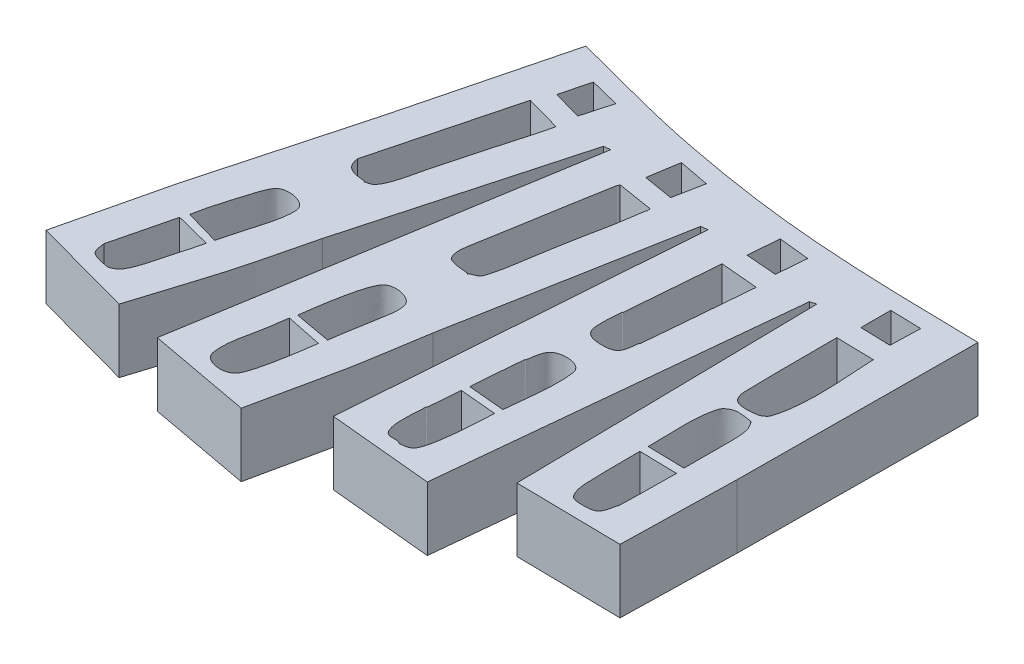
from build123d import *

# Parameters (mm, degrees)
BOSS_EXTRUDE1_DEPTH = 10


with BuildPart() as part:
    # Sketch1 → Boss-Extrude1 (new body)
    with BuildSketch(Plane(origin=(0, 0, 0), x_dir=(1, 0, 0), z_dir=(0, 1, 0))):
        with BuildLine():
            Line((105.416487086, 31.138290659), (105.155761657, -6.406171171))
            Line((105.155761657, -6.406171171), (104.764673512, -24.396225798))
            Line((104.764673512, -24.396225798), (88.338971462, -24.135500369))
            Line((88.338971462, -24.135500369), (87.556795174, 23.707615921))
            Line((87.556795174, 23.707615921), (86.644256171, 23.446890492))
            Line((86.644256171, 23.446890492), (81.169022154, -31.044724247))
            Line((81.169022154, -31.044724247), (64.873682818, -29.480371671))
            Line((64.873682818, -29.480371671), (68.914926973, 25.271968498))
            Line((68.914926973, 25.271968498), (67.872025256, 25.141605783))
            Line((67.872025256, 25.141605783), (61.353889521, -10.317052612))
            add(Edge.make_bspline(
                [(61.353889521, -10.317052612), (60.556431691, -15.101799596), (59.92344026, -19.92042284), (58.876997942, -24.656951228), (58.071680645, -28.302071624), (57.312645366, -31.95726325), (56.530469078, -35.607419262)],
                knots=[0, 0, 0, 0, 1, 1, 1, 2, 2, 2, 2], degree=3))
            Line((56.530469078, -35.607419262), (40.365492457, -32.609076824))
            Line((40.365492457, -32.609076824), (50.403421488, 28.531036365))
            Line((50.403421488, 28.531036365), (49.36051977, 28.40067365))
            Line((49.36051977, 28.40067365), (39.844041598, -6.145445742))
            add(Edge.make_bspline(
                [(39.844041598, -6.145445742), (38.60367941, -10.973998546), (37.570305388, -15.863546829), (36.063522872, -20.615707072), (34.962711789, -24.087495872), (33.890810961, -27.568385189), (32.804455005, -31.044724247)],
                knots=[0, 0, 0, 0, 1, 1, 1, 2, 2, 2, 2], degree=3))
            Line((32.804455005, -31.044724247), (17.030566528, -26.742754663))
            Line((17.030566528, -26.742754663), (21.071810683, -9.795601753))
            Line((21.071810683, -9.795601753), (27.720309132, 14.582225893))
            Line((27.720309132, 14.582225893), (34.368807581, 40.654768831))
            add(Edge.make_bspline(
                [(34.368807581, 40.654768831), (40.756580601, 39.046962016), (47.086410449, 37.18834127), (53.53212664, 35.831348387), (59.481123845, 34.578927923), (65.486798485, 33.563265788), (71.522181267, 32.83300595), (82.752489083, 31.474178669), (94.105923718, 31.331633622), (105.416487086, 31.138290659)],
                knots=[0, 0, 0, 0, 1, 1, 1, 2, 2, 2, 3, 3, 3, 3], degree=3))
        make_face()
        Polygon((39.844041598, 36.352799246), (44.537099327, 35.179534814), (43.23347218, 30.486477085), (38.670777166, 31.790104232), align=None, mode=Mode.SUBTRACT)
        Polygon((57.70373351, 32.311555091), (62.527153954, 31.399016088), (61.614614951, 26.705958359), (56.921557222, 27.488134647), align=None, mode=Mode.SUBTRACT)
        Polygon((75.824150852, 29.704300797), (80.647571295, 29.182849938), (80.256483151, 24.48979221), (75.433062708, 24.880880354), align=None, mode=Mode.SUBTRACT)
        with BuildLine():
            Line((37.367150019, 28.922124509), (42.97274675, 27.357771933))
            add(Edge.make_bspline(
                [(42.97274675, 27.357771933), (42.609783593, 25.542956145), (42.018290777, 23.771191553), (41.538756889, 22.01290063), (40.565925318, 18.445851536), (39.615031701, 14.864112534), (38.670777166, 11.323158026), (38.312800518, 9.980745599), (37.637387327, 5.782005371), (36.324248301, 5.065747721), (36.046524606, 4.914262069), (35.715888966, 4.891930768), (35.411709299, 4.805022292)],
                knots=[0, 0, 0, 0, 1, 1, 1, 2, 2, 2, 3, 3, 3, 4, 4, 4, 4], degree=3))
            add(Edge.make_bspline(
                [(35.411709299, 4.805022292), (35.36825506, 4.84847653), (35.34160677, 4.923332969), (35.281346584, 4.935385006), (34.895493125, 5.012555698), (34.49393561, 4.988577029), (34.108082152, 5.065747721), (32.62033794, 5.363296563), (32.018906099, 5.868159714), (31.761553287, 7.412276585)],
                knots=[0, 0, 0, 0, 1, 1, 1, 2, 2, 2, 3, 3, 3, 3], degree=3))
            Line((31.761553287, 7.412276585), (37.367150019, 28.922124509))
        make_face(mode=Mode.SUBTRACT)
        Polygon((94.205293623, 28.66139908), (99.028714066, 28.531036365), (98.898351352, 23.837978636), (94.205293623, 23.968341351), align=None, mode=Mode.SUBTRACT)
        with BuildLine():
            Line((55.878655505, 24.48979221), (61.484252236, 23.577253207))
            Line((61.484252236, 23.577253207), (61.614614951, 23.055802348))
            add(Edge.make_bspline(
                [(61.614614951, 23.055802348), (61.571160713, 23.01234811), (61.495108874, 22.985926616), (61.484252236, 22.925439633), (61.188919756, 21.280015816), (60.997408428, 19.617080293), (60.702075948, 17.971656475), (60.479853506, 16.733560014), (60.007701226, 14.645225721), (59.789536945, 13.408961461), (59.528811516, 11.931517361), (59.268086086, 10.454073262), (59.007360657, 8.976629162), (58.565114319, 6.47056658), (58.367124938, 3.927216851), (57.573370795, 1.545954424), (57.288364696, 0.690936126), (56.503410012, 0.867081785), (56.009018219, 0.372689992)],
                knots=[0, 0, 0, 0, 1, 1, 1, 2, 2, 2, 3, 3, 3, 4, 4, 4, 5, 5, 5, 6, 6, 6, 6], degree=3))
            add(Edge.make_bspline(
                [(56.009018219, 0.372689992), (55.965563981, 0.416144231), (55.939570001, 0.494930774), (55.878655505, 0.503052707), (55.553569249, 0.546397541), (53.029727105, 0.640724117), (52.619587637, 1.285228995), (51.904341675, 2.409186935), (52.298738405, 3.994261061), (52.489224923, 5.065747721), (53.36056852, 9.967055455), (54.103790951, 14.779860309), (54.966116502, 19.666371766), (55.226841931, 21.143815866), (55.48756736, 22.621259966), (55.74829279, 24.098704066), (55.75897252, 24.159222534), (55.859222178, 24.170766802), (55.878655505, 24.22906678), (55.906138378, 24.3115154), (55.878655505, 24.402883733), (55.878655505, 24.48979221)],
                knots=[0, 0, 0, 0, 1, 1, 1, 2, 2, 2, 3, 3, 3, 4, 4, 4, 5, 5, 5, 6, 6, 6, 7, 7, 7, 7], degree=3))
        make_face(mode=Mode.SUBTRACT)
        with BuildLine():
            Line((74.65088642, 21.752175201), (80.517208581, 21.230724342))
            add(Edge.make_bspline(
                [(80.517208581, 21.230724342), (80.03921196, 15.668581849), (79.600301979, 10.102941912), (79.083218719, 4.544296862), (79.077526682, 4.483107465), (78.962958909, 4.474551579), (78.952856004, 4.413934148), (78.825950173, 3.652499163), (78.880717184, 1.987210287), (77.909954287, 1.545954424), (77.583740092, 1.397675245), (77.225074749, 1.300146586), (76.867052569, 1.285228995), (74.968134757, 1.20610742), (73.276673621, 1.360229462), (73.216896558, 3.63175786), (73.18486832, 4.8488309), (73.263493112, 6.067304541), (73.347259273, 7.281913871), (73.351487407, 7.343221819), (73.472107961, 7.35107089), (73.477621987, 7.412276585), (73.907945753, 12.188870384), (74.259798276, 16.972208996), (74.65088642, 21.752175201)],
                knots=[0, 0, 0, 0, 1, 1, 1, 2, 2, 2, 3, 3, 3, 4, 4, 4, 5, 5, 5, 6, 6, 6, 7, 7, 7, 8, 8, 8, 8], degree=3))
        make_face(mode=Mode.SUBTRACT)
        with BuildLine():
            Line((93.683842764, 20.709273484), (99.550164925, 20.578910769))
            add(Edge.make_bspline(
                [(99.550164925, 20.578910769), (99.52923153, 18.192503788), (100.740759834, 9.680434167), (99.159076781, 4.935385006), (99.01777715, 4.511486113), (98.372865761, 4.084774549), (97.985812349, 4.022846004), (97.334307691, 3.918605258), (94.789450726, 3.506345371), (94.205293623, 4.674659577), (94.020932904, 5.043381015), (93.827604675, 5.435898724), (93.814205479, 5.847924009), (93.653185764, 10.799280238), (93.727297002, 15.755490325), (93.683842764, 20.709273484)],
                knots=[0, 0, 0, 0, 1, 1, 1, 2, 2, 2, 3, 3, 3, 4, 4, 4, 5, 5, 5, 5], degree=3))
        make_face(mode=Mode.SUBTRACT)
        with BuildLine():
            Line((99.41980221, -9.013425465), (93.683842764, -8.883062751))
            add(Edge.make_bspline(
                [(93.683842764, -8.883062751), (93.73808488, -4.977630433), (93.230309461, -1.832531365), (94.074930908, 1.545954424), (94.273441506, 2.339996818), (95.378556564, 2.886828132), (96.160734343, 2.849581571), (96.860619809, 2.816253692), (97.562544456, 2.740854658), (98.246537778, 2.588856142), (98.426508327, 2.548862687), (98.548092442, 2.358928262), (98.637625922, 2.197767998), (98.826379071, 1.858012329), (99.064811303, 1.531928192), (99.159076781, 1.15486628), (99.329016288, 0.475108252), (99.401841997, -0.230488838), (99.41980221, -0.930937155), (99.488860609, -3.624214706), (99.41980221, -6.319262695), (99.41980221, -9.013425465)],
                knots=[0, 0, 0, 0, 1, 1, 1, 2, 2, 2, 3, 3, 3, 4, 4, 4, 5, 5, 5, 6, 6, 6, 7, 7, 7, 7], degree=3))
        make_face(mode=Mode.SUBTRACT)
        with BuildLine():
            Line((31.631190573, -14.879747626), (26.155956556, -13.31539505))
            add(Edge.make_bspline(
                [(26.155956556, -13.31539505), (26.547325456, -11.162866096), (27.16978191, -8.97029184), (27.850671847, -6.92762203), (28.181034438, -5.936534256), (28.537580361, -4.143211767), (29.284661708, -3.147103304), (30.161184756, -1.978405907), (33.054420036, -2.564264211), (33.716994008, -3.668554163), (33.858392224, -3.904217858), (33.966278167, -4.176139974), (33.977719437, -4.450730451), (34.066495468, -6.581355197), (33.341412688, -8.564186731), (32.804455005, -10.577778041), (32.411071376, -12.052966648), (32.044900348, -13.431763413), (31.631190573, -14.879747626)],
                knots=[0, 0, 0, 0, 1, 1, 1, 2, 2, 2, 3, 3, 3, 4, 4, 4, 5, 5, 5, 6, 6, 6, 6], degree=3))
        make_face(mode=Mode.SUBTRACT)
        with BuildLine():
            Line((77.258140713, -15.27083577), (71.522181267, -14.749384911))
            add(Edge.make_bspline(
                [(71.522181267, -14.749384911), (71.739452458, -12.09867638), (71.917811187, -9.444490402), (72.173994841, -6.797259316), (72.179914306, -6.736091501), (72.291481244, -6.726986053), (72.304357555, -6.666896601), (72.485675113, -5.820747999), (72.493421686, -4.084969393), (73.477621987, -3.538191448), (74.763521852, -2.823802635), (77.550821502, -3.011658034), (77.779591572, -4.841818595), (78.192721468, -8.146857766), (77.531973808, -12.053296902), (77.258140713, -15.27083577)],
                knots=[0, 0, 0, 0, 1, 1, 1, 2, 2, 2, 3, 3, 3, 4, 4, 4, 5, 5, 5, 5], degree=3))
        make_face(mode=Mode.SUBTRACT)
        with BuildLine():
            Line((54.053577499, -19.572805355), (48.317618053, -18.529903637))
            add(Edge.make_bspline(
                [(48.317618053, -18.529903637), (48.468234794, -17.6073761), (49.393198409, -9.641846891), (50.794509632, -7.840161033), (51.721341211, -6.648520431), (54.623516507, -7.285323759), (55.226841931, -8.491974606), (55.800602847, -9.639496438), (55.393354488, -11.437083219), (55.226841931, -12.402856047), (55.00957074, -13.663028956), (54.807877916, -14.925987158), (54.575028358, -16.183374773), (54.366881663, -17.307366926), (54.227394452, -18.442995161), (54.053577499, -19.572805355)],
                knots=[0, 0, 0, 0, 1, 1, 1, 2, 2, 2, 3, 3, 3, 4, 4, 4, 5, 5, 5, 5], degree=3))
        make_face(mode=Mode.SUBTRACT)
        with BuildLine():
            Line((93.683842764, -10.186689897), (99.550164925, -10.317052612))
            add(Edge.make_bspline(
                [(99.550164925, -10.317052612), (99.506710687, -13.31539505), (99.505443185, -16.314645811), (99.41980221, -19.312079926), (99.41804711, -19.373508431), (99.301491533, -19.382182454), (99.289439496, -19.44244264), (99.105051382, -20.364383206), (99.031796093, -21.762529119), (97.725086919, -21.919334219), (97.658520001, -21.92732225), (95.189968648, -22.270229677), (94.596381767, -21.528246075), (94.042034908, -20.835312502), (93.862009325, -19.749591789), (93.814205479, -18.920991782), (93.714061656, -17.185165524), (93.709790809, -15.445002185), (93.683842764, -13.706483194), (93.666333305, -12.533349422), (93.683842764, -11.35995433), (93.683842764, -10.186689897)],
                knots=[0, 0, 0, 0, 1, 1, 1, 2, 2, 2, 3, 3, 3, 4, 4, 4, 5, 5, 5, 6, 6, 6, 7, 7, 7, 7], degree=3))
        make_face(mode=Mode.SUBTRACT)
        with BuildLine():
            Line((25.764868412, -14.488659482), (31.370465143, -15.922649344))
            add(Edge.make_bspline(
                [(31.370465143, -15.922649344), (30.977187811, -17.757943563), (30.420850281, -19.49147898), (29.936475282, -21.267520646), (29.495132013, -22.885779297), (29.203004372, -24.649074518), (28.241759991, -26.090941089), (28.027939674, -26.411671565), (27.20932, -26.8922388), (26.807770129, -26.873117377), (26.49583288, -26.858263223), (24.444283261, -26.521125991), (23.939790406, -25.960578375), (23.504568298, -25.476998255), (23.490375251, -24.581423285), (23.418339547, -24.005137654)],
                knots=[0, 0, 0, 0, 1, 1, 1, 2, 2, 2, 3, 3, 3, 4, 4, 4, 5, 5, 5, 5], degree=3))
            Line((23.418339547, -24.005137654), (25.764868412, -14.488659482))
        make_face(mode=Mode.SUBTRACT)
        with BuildLine():
            Line((71.391818552, -15.922649344), (77.127777999, -16.444100202))
            add(Edge.make_bspline(
                [(77.127777999, -16.444100202), (77.113699942, -16.641193001), (76.829385291, -26.002012381), (75.563425422, -27.394568236), (75.035370697, -27.975428434), (74.426505223, -27.948073552), (73.738347417, -28.04638181)],
                knots=[0, 0, 0, 0, 1, 1, 1, 2, 2, 2, 2], degree=3))
            add(Edge.make_bspline(
                [(73.738347417, -28.04638181), (73.132482993, -27.440517386), (72.016469417, -28.108454939), (71.391818552, -27.394568236), (70.927606243, -26.864039883), (70.752517035, -25.586057774), (70.740004979, -25.048039372), (70.708669682, -23.700621609), (70.786295358, -22.351952594), (70.870367694, -21.006795217), (70.874201062, -20.945461319), (70.99446037, -20.937565376), (71.000730408, -20.876432502), (71.169730915, -19.228677565), (71.261455838, -17.573910396), (71.391818552, -15.922649344)],
                knots=[0, 0, 0, 0, 1, 1, 1, 2, 2, 2, 3, 3, 3, 4, 4, 4, 5, 5, 5, 5], degree=3))
        make_face(mode=Mode.SUBTRACT)
        with BuildLine():
            Line((48.056892623, -19.572805355), (53.79285207, -20.746069787))
            add(Edge.make_bspline(
                [(53.79285207, -20.746069787), (53.709705193, -21.255344408), (52.681893596, -29.476177675), (51.446323205, -31.175086962), (50.484607967, -32.497445415), (47.081164916, -32.065994877), (46.753265476, -30.262547959), (46.326318043, -27.914337077), (47.131740951, -25.353323209), (47.535441765, -23.092598652), (47.743941746, -21.924998755), (47.88307567, -20.746069787), (48.056892623, -19.572805355)],
                knots=[0, 0, 0, 0, 1, 1, 1, 2, 2, 2, 3, 3, 3, 4, 4, 4, 4], degree=3))
        make_face(mode=Mode.SUBTRACT)
    extrude(amount=BOSS_EXTRUDE1_DEPTH)


solid = part.part
